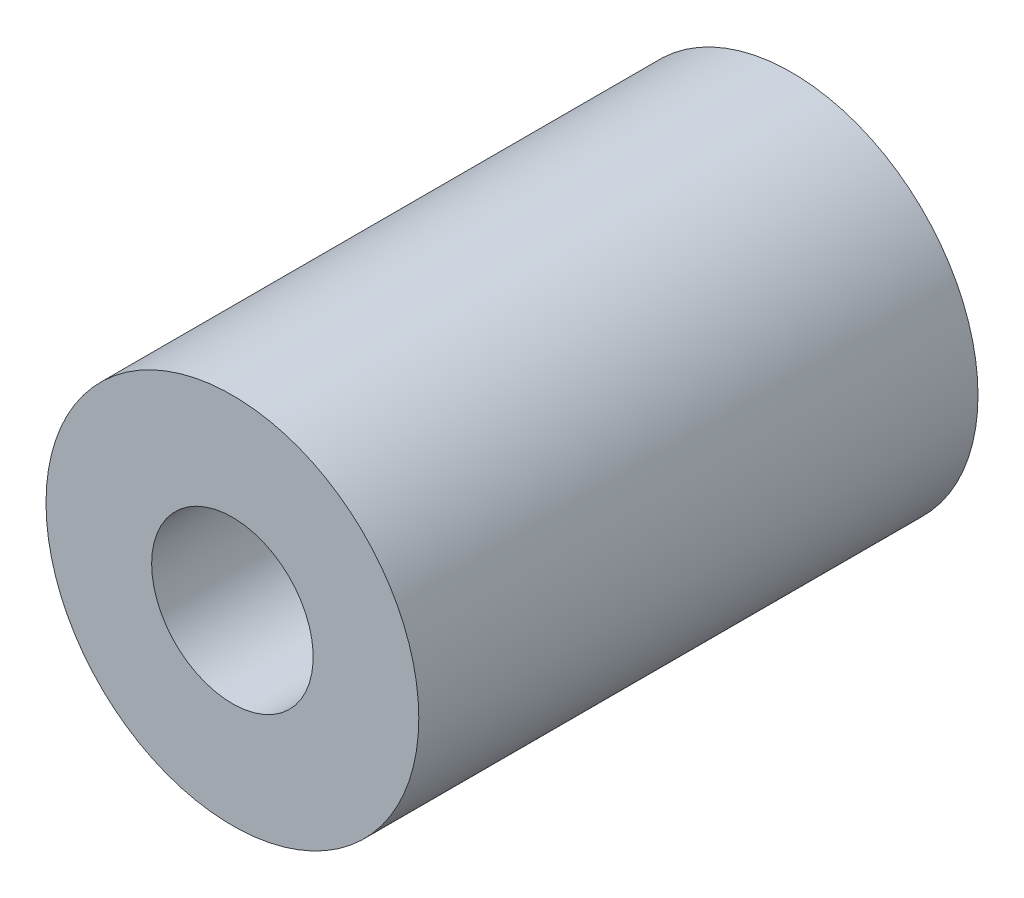
from build123d import *

# Parameters (mm, degrees)
SKETCH_1_R      = 15
SKETCH_1_R_2    = 6.5
EXTRUDE_1_DEPTH = 22.5


with BuildPart() as part:
    # 草图1 → 拉伸1 (new, symmetric)
    with BuildSketch(Plane.XY):
        with Locations(Location((0, 0, 0), (0, 0, 180))):
            Circle(SKETCH_1_R)
        with Locations(Location((0, 0, 0), (0, 0, 180))):
            Circle(SKETCH_1_R_2, mode=Mode.SUBTRACT)
    extrude(amount=EXTRUDE_1_DEPTH, both=True)


solid = part.part
